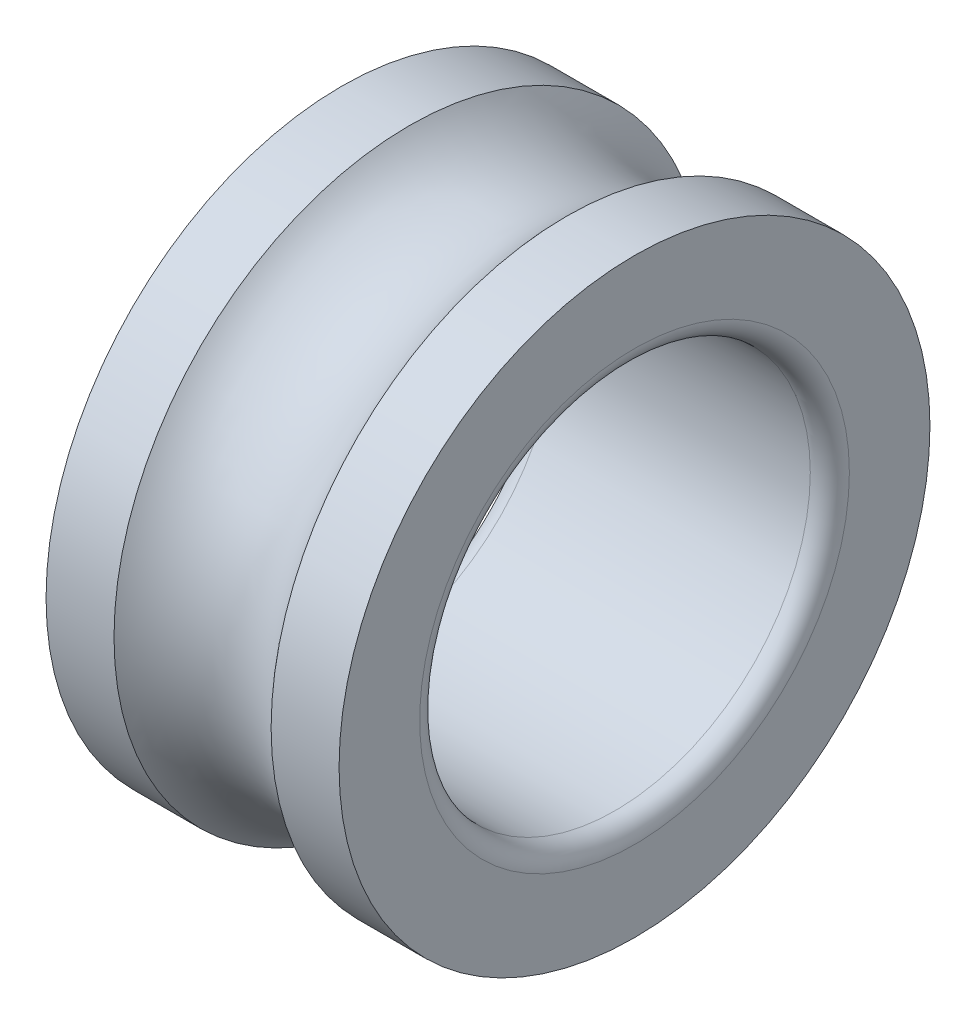
from build123d import *

# Parameters (mm, degrees)
SKETCH1_R           = 15.125
SKETCH1_R_2         = 10
BOSS_EXTRUDE1_DEPTH = 7.5
SKETCH2_R           = 5.25
FILLET1_R           = 1


with BuildPart() as part:
    # Sketch1 → Boss-Extrude1 (new, symmetric)
    with BuildSketch(Plane(origin=(0, 0, 0), x_dir=(0, 0, -1), z_dir=(1, 0, 0))):
        Circle(SKETCH1_R)
        Circle(SKETCH1_R_2, mode=Mode.SUBTRACT)
    extrude(amount=BOSS_EXTRUDE1_DEPTH, both=True)

    # Sketch2 → Cut-Revolve1 (revolve, cut)
    with BuildSketch(Plane.XY, mode=Mode.PRIVATE) as cut_revolve1_sk:
        with Locations((0, 18.5)):
            Circle(SKETCH2_R)
    revolve(cut_revolve1_sk.sketch.rotate(Axis((0, 0, 0), (1, 0, 0)), 90), axis=Axis((0, 0, 0), (1, 0, 0)), mode=Mode.SUBTRACT)

    # Fillet1
    fillet1_edges = [part.edges().sort_by_distance(p)[0] for p in [
        (-7.5, 0, 10),
        (7.5, 0, 10),
    ]]
    fillet(fillet1_edges, radius=FILLET1_R)


solid = part.part
